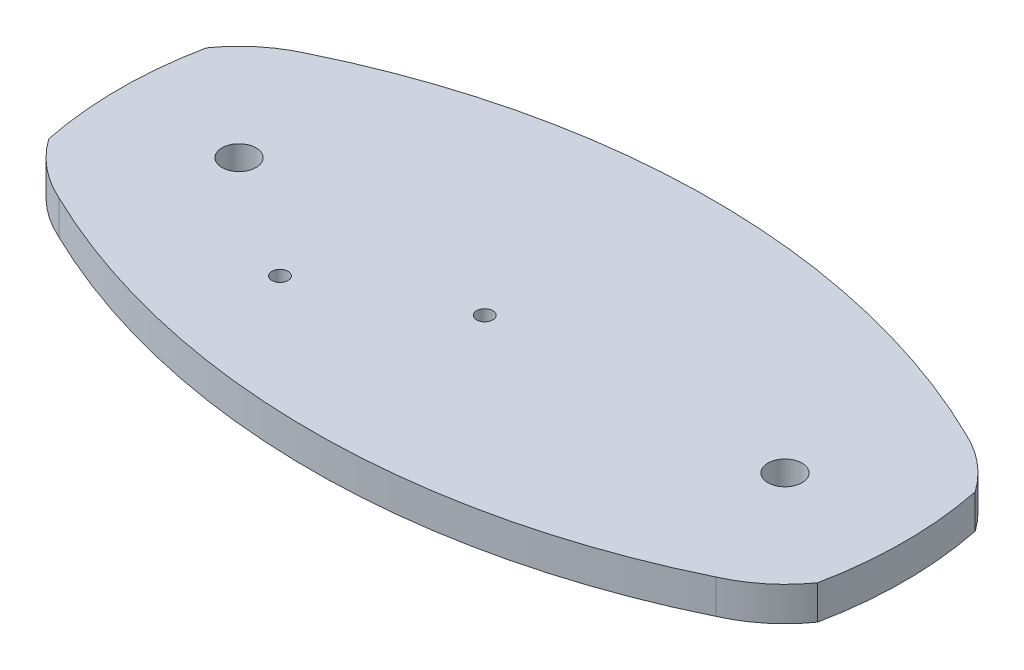
from build123d import *

# Parameters (mm, degrees)
SKETCH1_R             = 73.025
BOSS_EXTRUDE1_DEPTH   = 6.35
CUT_EXTRUDE2_START    = -6.35
SKETCH2_R             = 3.175
CUT_EXTRUDE2_DEPTH    = 6.35
F_3_0MM_DOWEL_HOLE1_D = 3


with BuildPart() as part:
    # Sketch1 → Boss-Extrude1 (new body)
    with BuildSketch(Plane(origin=(0, 0, 0), x_dir=(1, 0, 0), z_dir=(0, 1, 0))):
        with Locations(Location((0, 0, 0), (0, 0, 270))):
            Circle(SKETCH1_R)
    extrude(amount=BOSS_EXTRUDE1_DEPTH)

    # Sketch2 → Cut-Extrude2 (cut)
    with BuildSketch(Plane(origin=(0, 6.35, 0), x_dir=(1, 0, 0), z_dir=(0, 1, 0)).offset(CUT_EXTRUDE2_START)):
        with BuildLine():
            ThreePointArc((61.150770614, -23.195291499), (0, -37.290063688), (-61.150770614, -23.195291499))
            ThreePointArc((-61.150770614, -23.195291499), (-66.917906968, -19.630921399), (-71.53671875, -14.667941079))
            ThreePointArc((-71.53671875, -14.667941079), (0, -73.025), (71.53671875, -14.667941079))
            ThreePointArc((71.53671875, -14.667941079), (66.917906968, -19.630921399), (61.150770614, -23.195291499))
        make_face()
        with BuildLine():
            ThreePointArc((-61.150770614, 23.195291499), (0, 37.290063688), (61.150770614, 23.195291499))
            ThreePointArc((61.150770614, 23.195291499), (66.917906968, 19.630921399), (71.53671875, 14.667941079))
            ThreePointArc((71.53671875, 14.667941079), (0, 73.025), (-71.53671875, 14.667941079))
            ThreePointArc((-71.53671875, 14.667941079), (-66.917906968, 19.630921399), (-61.150770614, 23.195291499))
        make_face()
        with Locations(Location((-50.8, 0, 0), (0, 0, 270))):
            Circle(SKETCH2_R)
        with Locations(Location((50.8, 0, 0), (0, 0, 270))):
            Circle(SKETCH2_R)
    extrude(amount=CUT_EXTRUDE2_DEPTH, mode=Mode.SUBTRACT)

    # Ø3.0mm Dowel Hole1 (through all)
    with Locations(Plane(origin=(0, 6.35, 0), x_dir=(1, 0, 0), z_dir=(0, 1, 0))):
        with Locations((-27.94, -15.24), (-2.54, -2.54)):
            Hole(F_3_0MM_DOWEL_HOLE1_D / 2)


solid = part.part
